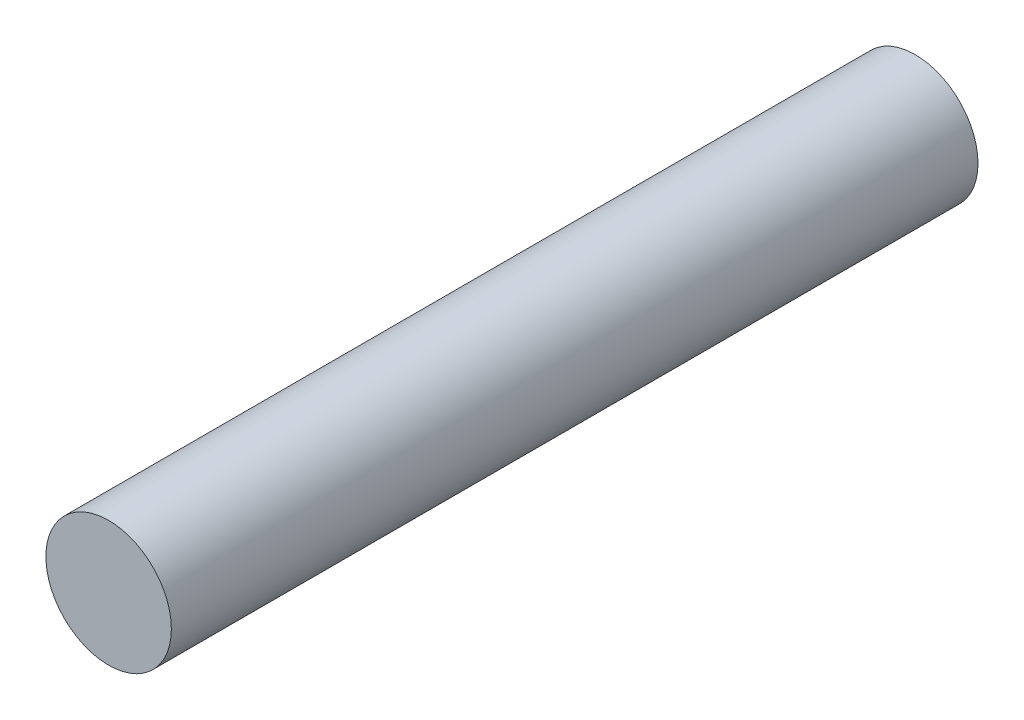
from build123d import *

# Parameters (mm, degrees)
SKETCH1_R           = 1.778
BOSS_EXTRUDE1_DEPTH = 11.43


with BuildPart() as part:
    # Sketch1 → Boss-Extrude1 (new, symmetric)
    with BuildSketch(Plane.XY):
        Circle(SKETCH1_R)
    extrude(amount=BOSS_EXTRUDE1_DEPTH, both=True)


solid = part.part
